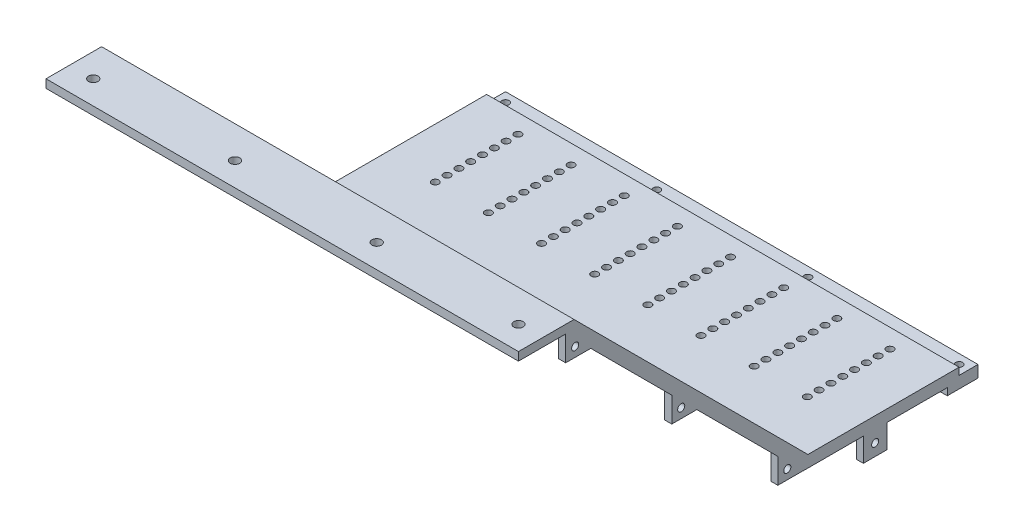
from build123d import *

# Parameters (mm, degrees)
EXTRUDE_THIN2_DEPTH  = 200
CUT_EXTRUDE2_REACH   = 285.304
SKETCH6_R            = 1.5
LPATTERN1_COUNT      = 8
LPATTERN1_PITCH      = 5
LPATTERN1_COUNT_DIR2 = 8
LPATTERN1_PITCH_DIR2 = 22.5
CUT_EXTRUDE3_REACH   = 286.366
SKETCH7_R            = 1.5
LPATTERN2_COUNT      = 4
LPATTERN2_PITCH      = 64
CUT_EXTRUDE4_REACH   = 281.713
SKETCH8_R            = 1.5
SKETCH8_W            = 165
SKETCH8_H            = 106
BOSS_EXTRUDE1_DEPTH  = 200
SKETCH10_W           = 200
SKETCH10_H           = 3.535533906
BOSS_EXTRUDE2_DEPTH  = 20
CUT_EXTRUDE5_REACH   = 300.814
SKETCH11_R           = 2
LPATTERN3_COUNT      = 4
LPATTERN3_PITCH      = 60
BOSS_EXTRUDE3_DEPTH  = 3
CUT_EXTRUDE6_REACH   = 299.061
SKETCH13_R           = 1.5
LPATTERN4_COUNT      = 3
LPATTERN4_PITCH      = 63.5
LPATTERN4_COUNT_DIR2 = 2
LPATTERN4_PITCH_DIR2 = 197
SKETCH16_W           = 3
SKETCH16_H           = 10
BOSS_EXTRUDE4_DEPTH  = 10
CUT_EXTRUDE7_REACH   = 299.061
SKETCH17_R           = 1.5


with BuildPart() as part:
    # Sketch4 → Extrude-Thin2 (new body)
    with BuildSketch(Plane(origin=(0, 0, 0), x_dir=(0, 0, -1), z_dir=(1, 0, 0))):
        Polygon((0, 0), (-8, 0), (-8, 3), (-72, 3), (-170.994949366, 101.994949366), (-174.530483272, 98.45941546), (-74.071067812, -2), (-13, -2), (-13, -5), (0, -5), align=None)
    extrude(amount=EXTRUDE_THIN2_DEPTH)

    # Sketch6 → Cut-Extrude2 (cut, up to next)
    with BuildSketch(Plane(origin=(0, 3, 0), x_dir=(1, 0, 0), z_dir=(0, 1, 0)), mode=Mode.PRIVATE) as cut_extrude2_sk1:
        with Locations(Location((178.75, -16, 0), (0, 0, 270))):
            Circle(SKETCH6_R)
    cut_extrude2_tool1 = extrude(cut_extrude2_sk1.sketch, amount=-CUT_EXTRUDE2_REACH, mode=Mode.PRIVATE) & part.part
    cut_extrude2 = cut_extrude2_tool1.solids().sort_by_distance((178.75, 3, 16))[0]
    add(cut_extrude2, mode=Mode.SUBTRACT)

    # LPattern1: Cut-Extrude2 8 × 8
    with Locations(*[(-j * LPATTERN1_PITCH_DIR2, 0, i * LPATTERN1_PITCH) for i in range(LPATTERN1_COUNT) for j in range(LPATTERN1_COUNT_DIR2) if (i, j) != (0, 0)]):
        add(cut_extrude2, mode=Mode.SUBTRACT)

    # Sketch7 → Cut-Extrude3 (cut, up to next)
    with BuildSketch(Plane(origin=(0, 0, 0), x_dir=(1, 0, 0), z_dir=(0, 1, 0)), mode=Mode.PRIVATE) as cut_extrude3_sk1:
        with Locations(Location((196, -4, 0), (0, 0, 270))):
            Circle(SKETCH7_R)
    cut_extrude3_tool1 = extrude(cut_extrude3_sk1.sketch, amount=-CUT_EXTRUDE3_REACH, mode=Mode.PRIVATE) & part.part
    cut_extrude3 = cut_extrude3_tool1.solids().sort_by_distance((196, 0, 4))[0]
    add(cut_extrude3, mode=Mode.SUBTRACT)

    # LPattern2: Cut-Extrude3 ×4
    with Locations(*[(-i * LPATTERN2_PITCH, 0, 0) for i in range(1, LPATTERN2_COUNT)]):
        add(cut_extrude3, mode=Mode.SUBTRACT)

    # Sketch8 → Cut-Extrude4 (cut, up to next)
    with BuildSketch(Plane(origin=(0, -34.5, 34.5), x_dir=(1, 0, 0), z_dir=(0, 0.7071067811865465, -0.7071067811865486)), mode=Mode.PRIVATE) as cut_extrude4_sk1:
        with Locations(Location((19, -180.533008589, 0), (0, 0, 270))):
            Circle(SKETCH8_R)
    cut_extrude4_tool1 = extrude(cut_extrude4_sk1.sketch, amount=-CUT_EXTRUDE4_REACH, mode=Mode.PRIVATE) & part.part
    # Sketch8 → Cut-Extrude4 (cut, up to next)
    with BuildSketch(Plane(origin=(0, -34.5, 34.5), x_dir=(1, 0, 0), z_dir=(0, 0.7071067811865465, -0.7071067811865486)), mode=Mode.PRIVATE) as cut_extrude4_sk2:
        with Locations(Location((19, -65.533008589, 0), (0, 0, 270))):
            Circle(SKETCH8_R)
    cut_extrude4_tool2 = extrude(cut_extrude4_sk2.sketch, amount=-CUT_EXTRUDE4_REACH, mode=Mode.PRIVATE) & part.part
    # Sketch8 → Cut-Extrude4 (cut, up to next)
    with BuildSketch(Plane(origin=(0, -34.5, 34.5), x_dir=(1, 0, 0), z_dir=(0, 0.7071067811865465, -0.7071067811865486)), mode=Mode.PRIVATE) as cut_extrude4_sk3:
        with Locations(Location((181, -65.533008589, 0), (0, 0, 270))):
            Circle(SKETCH8_R)
    cut_extrude4_tool3 = extrude(cut_extrude4_sk3.sketch, amount=-CUT_EXTRUDE4_REACH, mode=Mode.PRIVATE) & part.part
    # Sketch8 → Cut-Extrude4 (cut, up to next)
    with BuildSketch(Plane(origin=(0, -34.5, 34.5), x_dir=(1, 0, 0), z_dir=(0, 0.7071067811865465, -0.7071067811865486)), mode=Mode.PRIVATE) as cut_extrude4_sk4:
        with Locations(Location((181, -180.533008589, 0), (0, 0, 270))):
            Circle(SKETCH8_R)
    cut_extrude4_tool4 = extrude(cut_extrude4_sk4.sketch, amount=-CUT_EXTRUDE4_REACH, mode=Mode.PRIVATE) & part.part
    # Sketch8 → Cut-Extrude4 (cut, up to next)
    with BuildSketch(Plane(origin=(0, -34.5, 34.5), x_dir=(1, 0, 0), z_dir=(0, 0.7071067811865465, -0.7071067811865486)), mode=Mode.PRIVATE) as cut_extrude4_sk5:
        with Locations((100, -123.033008589)):
            Rectangle(SKETCH8_W, SKETCH8_H)
    cut_extrude4_tool5 = extrude(cut_extrude4_sk5.sketch, amount=-CUT_EXTRUDE4_REACH, mode=Mode.PRIVATE) & part.part
    add(cut_extrude4_tool1.solids().sort_by_distance((19, 93.156115, 162.156115))[0], mode=Mode.SUBTRACT)
    add(cut_extrude4_tool2.solids().sort_by_distance((19, 11.838835, 80.838835))[0], mode=Mode.SUBTRACT)
    add(cut_extrude4_tool3.solids().sort_by_distance((181, 11.838835, 80.838835))[0], mode=Mode.SUBTRACT)
    add(cut_extrude4_tool4.solids().sort_by_distance((181, 93.156115, 162.156115))[0], mode=Mode.SUBTRACT)
    add(cut_extrude4_tool5.solids().sort_by_distance((100, 52.497475, 121.497475))[0], mode=Mode.SUBTRACT)

    # Sketch9 → Boss-Extrude1 (add)
    with BuildSketch(Plane(origin=(200, 0, 0), x_dir=(0, 0, -1), z_dir=(1, 0, 0))):
        Polygon((-170.994949366, 101.994949366), (-174.530483272, 101.994949366), (-174.530483272, 98.45941546), align=None)
    extrude(amount=-BOSS_EXTRUDE1_DEPTH)

    # Sketch10 → Boss-Extrude2 (add)
    with BuildSketch(Plane.XY.offset(174.530483272)):
        with Locations((100, 100.227182413)):
            Rectangle(SKETCH10_W, SKETCH10_H)
    extrude(amount=BOSS_EXTRUDE2_DEPTH)

    # Sketch11 → Cut-Extrude5 (cut, up to next)
    with BuildSketch(Plane(origin=(0, 101.994949366, 0), x_dir=(1, 0, 0), z_dir=(0, 1, 0)), mode=Mode.PRIVATE) as cut_extrude5_sk1:
        with Locations(Location((190, -184.530483272, 0), (0, 0, 270))):
            Circle(SKETCH11_R)
    cut_extrude5_tool1 = extrude(cut_extrude5_sk1.sketch, amount=-CUT_EXTRUDE5_REACH, mode=Mode.PRIVATE) & part.part
    cut_extrude5 = cut_extrude5_tool1.solids().sort_by_distance((190, 101.994949, 184.530483))[0]
    add(cut_extrude5, mode=Mode.SUBTRACT)

    # LPattern3: Cut-Extrude5 ×4
    with Locations(*[(-i * LPATTERN3_PITCH, 0, 0) for i in range(1, LPATTERN3_COUNT)]):
        add(cut_extrude5, mode=Mode.SUBTRACT)

    # Sketch12 → Boss-Extrude3 (add)
    with BuildSketch(Plane(origin=(200, 0, 0), x_dir=(0, 0, -1), z_dir=(1, 0, 0))):
        Polygon((-174.530483272, 98.45941546), (-174.530483272, 87.852813742), (-163.923881554, 87.852813742), align=None)
    boss_extrude3 = extrude(amount=-BOSS_EXTRUDE3_DEPTH)

    # Sketch13 → Cut-Extrude6 (cut, up to next)
    with BuildSketch(Plane(origin=(200, 0, 0), x_dir=(0, 0, -1), z_dir=(1, 0, 0)), mode=Mode.PRIVATE) as cut_extrude6_sk1:
        with Locations((-170.530483272, 91.852813742)):
            Circle(SKETCH13_R)
    cut_extrude6_tool1 = extrude(cut_extrude6_sk1.sketch, amount=-CUT_EXTRUDE6_REACH, mode=Mode.PRIVATE) & part.part
    cut_extrude6 = cut_extrude6_tool1.solids().sort_by_distance((200, 91.852814, 170.530483))[0]
    add(cut_extrude6, mode=Mode.SUBTRACT)

    # LPattern4: Boss-Extrude3, Cut-Extrude6 3 × 2
    with Locations(*[Vector(0, -0.7071067811865724, -0.7071067811865227) * (i * LPATTERN4_PITCH) + Vector(-1, 0, 0) * (j * LPATTERN4_PITCH_DIR2) for i in range(LPATTERN4_COUNT) for j in range(LPATTERN4_COUNT_DIR2) if (i, j) != (0, 0)]):
        add(boss_extrude3)
        add(cut_extrude6, mode=Mode.SUBTRACT)

    # Sketch16 → Boss-Extrude4 (add)
    with BuildSketch(Plane.XZ.offset(2)):
        with Locations((198.5, 43.536067812)):
            Rectangle(SKETCH16_W, SKETCH16_H)
    extrude(amount=BOSS_EXTRUDE4_DEPTH)

    # Sketch17 → Cut-Extrude7 (cut, up to next)
    with BuildSketch(Plane(origin=(200, 0, 0), x_dir=(0, 0, -1), z_dir=(1, 0, 0)), mode=Mode.PRIVATE) as cut_extrude7_sk1:
        with Locations((-43.536067812, -7)):
            Circle(SKETCH17_R)
    cut_extrude7_tool1 = extrude(cut_extrude7_sk1.sketch, amount=-CUT_EXTRUDE7_REACH, mode=Mode.PRIVATE) & part.part
    add(cut_extrude7_tool1.solids().sort_by_distance((200, -7, 43.536068))[0], mode=Mode.SUBTRACT)


solid = part.part
